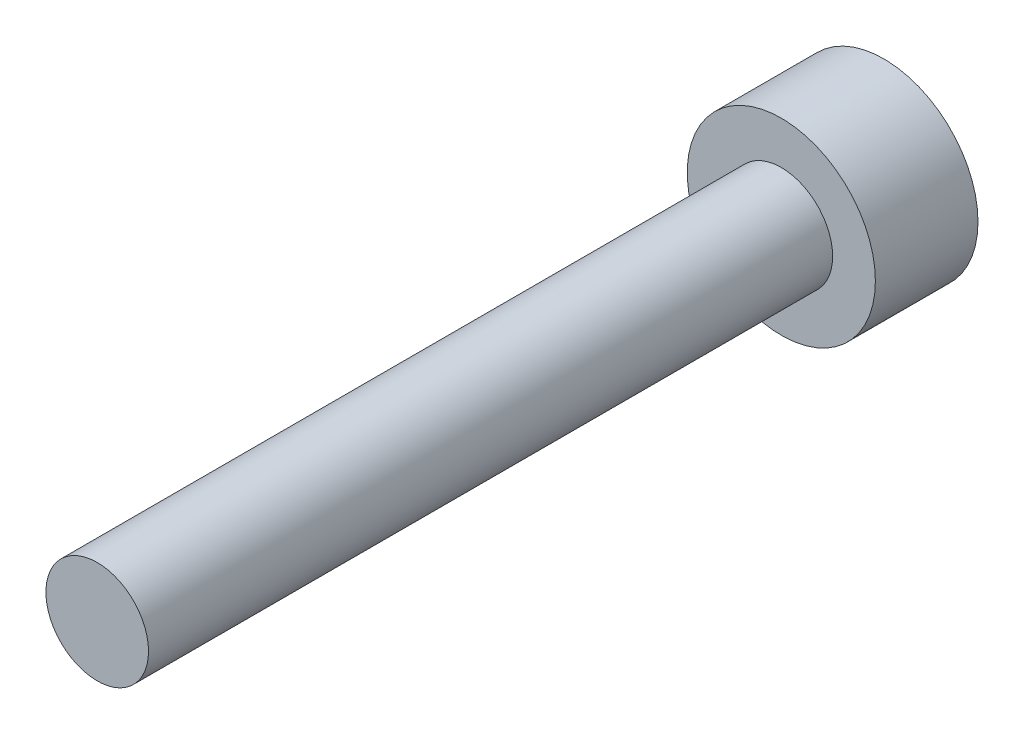
from build123d import *

# Parameters (mm, degrees)
ESBO_O1_R                = 2.75
RESSALTO_EXTRUS_O1_DEPTH = 3
ESBO_O2_R                = 1.5
RESSALTO_EXTRUS_O2_DEPTH = 20


with BuildPart() as part:
    # Esboço1 → Ressalto-extrusão1 (new body)
    with BuildSketch(Plane.XY):
        Circle(ESBO_O1_R)
    extrude(amount=RESSALTO_EXTRUS_O1_DEPTH)

    # Esboço2 → Ressalto-extrusão2 (add)
    with BuildSketch(Plane.XY.offset(3)):
        Circle(ESBO_O2_R)
    extrude(amount=RESSALTO_EXTRUS_O2_DEPTH)


solid = part.part
